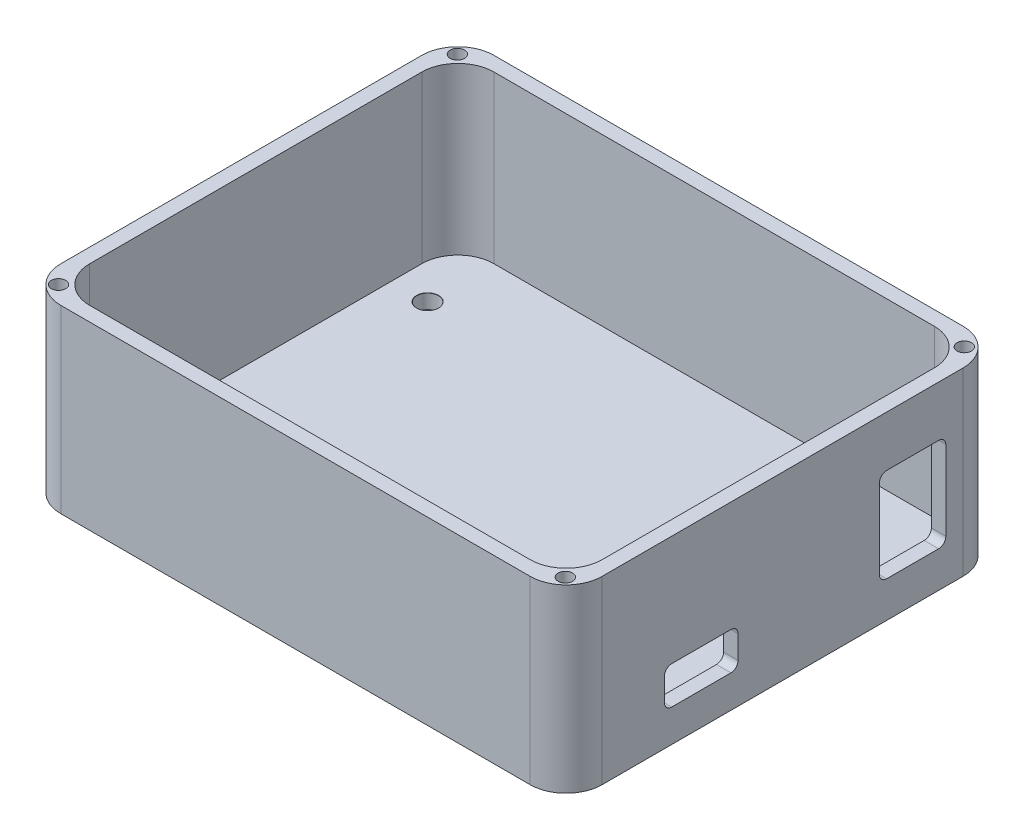
from build123d import *

# Parameters (mm, degrees)
SKIZZE1_W                                = 75
SKIZZE1_H                                = 60
AUFSATZ_LINEAR_AUSTRAGEN1_DEPTH          = 25
WANDUNG1_T                               = -2
VERRUNDUNG1_R                            = 5
SKIZZE2_W                                = 9.2
SKIZZE2_H                                = 13
SCHNITT_LINEAR_AUSTRAGEN1_DEPTH          = 25
VERRUNDUNG2_R                            = 1
SKIZZE3_W                                = 10.2
SKIZZE3_H                                = 5.2
SCHNITT_LINEAR_AUSTRAGEN2_DEPTH          = 25
VERRUNDUNG3_R                            = 1
F_3_0_3_DURCHMESSER_BOHRUNG1_D           = 3
F_3_0_3_DURCHMESSER_BOHRUNG1_CSINK_D     = 3.05
F_3_0_3_DURCHMESSER_BOHRUNG1_CSINK_ANGLE = 90
F_2_0_2_DURCHMESSER_BOHRUNG1_D           = 2
F_2_0_2_DURCHMESSER_BOHRUNG1_DEPTH       = 20
F_2_0_2_DURCHMESSER_BOHRUNG1_CSINK_D     = 2.05
F_2_0_2_DURCHMESSER_BOHRUNG1_CSINK_ANGLE = 90
F_2_0_2_DURCHMESSER_BOHRUNG1_TIP         = 0.600860619


with BuildPart() as part:
    # Skizze1 → Aufsatz-Linear austragen1 (new body)
    with BuildSketch(Plane(origin=(0, 0, 0), x_dir=(1, 0, 0), z_dir=(0, 1, 0))):
        Rectangle(SKIZZE1_W, SKIZZE1_H)
    extrude(amount=AUFSATZ_LINEAR_AUSTRAGEN1_DEPTH)

    # Wandung1
    wandung1_openings = [part.faces().sort_by_distance(p)[0] for p in [
        (0, 25, 0),
    ]]
    offset(amount=WANDUNG1_T, openings=wandung1_openings, kind=Kind.INTERSECTION)

    # Verrundung1
    verrundung1_edges = [part.edges().sort_by_distance(p)[0] for p in [
        (35.5, 13.5, 28),
        (35.5, 13.5, -28),
        (-35.5, 13.5, -28),
        (-35.5, 13.5, 28),
        (37.5, 12.5, 30),
        (-37.5, 12.5, 30),
        (-37.5, 12.5, -30),
        (37.5, 12.5, -30),
    ]]
    fillet(verrundung1_edges, radius=VERRUNDUNG1_R)

    # Skizze2 → Schnitt-Linear austragen1 (cut)
    with BuildSketch(Plane(origin=(37.5, 0, 0), x_dir=(0, 0, -1), z_dir=(1, 0, 0))):
        with Locations((18, 11.5)):
            Rectangle(SKIZZE2_W, SKIZZE2_H)
    extrude(amount=-SCHNITT_LINEAR_AUSTRAGEN1_DEPTH, mode=Mode.SUBTRACT)

    # Verrundung2
    verrundung2_edges = [part.edges().sort_by_distance(p)[0] for p in [
        (36.5, 5, -13.4),
        (36.5, 18, -13.4),
        (36.5, 18, -22.6),
        (36.5, 5, -22.6),
    ]]
    fillet(verrundung2_edges, radius=VERRUNDUNG2_R)

    # Skizze3 → Schnitt-Linear austragen2 (cut)
    with BuildSketch(Plane(origin=(37.5, 0, 0), x_dir=(0, 0, -1), z_dir=(1, 0, 0))):
        with Locations((-11.28, 7.1)):
            Rectangle(SKIZZE3_W, SKIZZE3_H)
    extrude(amount=-SCHNITT_LINEAR_AUSTRAGEN2_DEPTH, mode=Mode.SUBTRACT)

    # Verrundung3
    verrundung3_edges = [part.edges().sort_by_distance(p)[0] for p in [
        (36.5, 4.5, 16.38),
        (36.5, 9.7, 16.38),
        (36.5, 9.7, 6.18),
        (36.5, 4.5, 6.18),
    ]]
    fillet(verrundung3_edges, radius=VERRUNDUNG3_R)

    # Ø3.0 (3) Durchmesser Bohrung1 (through all)
    with Locations(Plane(origin=(0, 2, 0), x_dir=(1, 0, 0), z_dir=(0, 1, 0))):
        with Locations((21.546108128, 23.974231713), (-30.532956337, 18.838889879), (-30.532956337, -9.070576608), (20.26227267, -24.309145311)):
            CounterSinkHole(F_3_0_3_DURCHMESSER_BOHRUNG1_D / 2, F_3_0_3_DURCHMESSER_BOHRUNG1_CSINK_D / 2, counter_sink_angle=F_3_0_3_DURCHMESSER_BOHRUNG1_CSINK_ANGLE)

    # Ø2.0 (2) Durchmesser Bohrung1
    with Locations(Plane(origin=(0, 28, 0), x_dir=(1, 0, 0), z_dir=(0, 1, 0))):
        with Locations((-35.165927774, 27.602462356), (35.054289908, 27.602462356), (35.054289908, -27.658281289), (-35.165927774, -27.658281289)):
            CounterSinkHole(F_2_0_2_DURCHMESSER_BOHRUNG1_D / 2, F_2_0_2_DURCHMESSER_BOHRUNG1_CSINK_D / 2, depth=F_2_0_2_DURCHMESSER_BOHRUNG1_DEPTH, counter_sink_angle=F_2_0_2_DURCHMESSER_BOHRUNG1_CSINK_ANGLE)
            with Locations((0, 0, -(F_2_0_2_DURCHMESSER_BOHRUNG1_DEPTH + F_2_0_2_DURCHMESSER_BOHRUNG1_TIP / 2))):  # 118° drill point
                Cone(0, F_2_0_2_DURCHMESSER_BOHRUNG1_D / 2, F_2_0_2_DURCHMESSER_BOHRUNG1_TIP, mode=Mode.SUBTRACT)


solid = part.part
